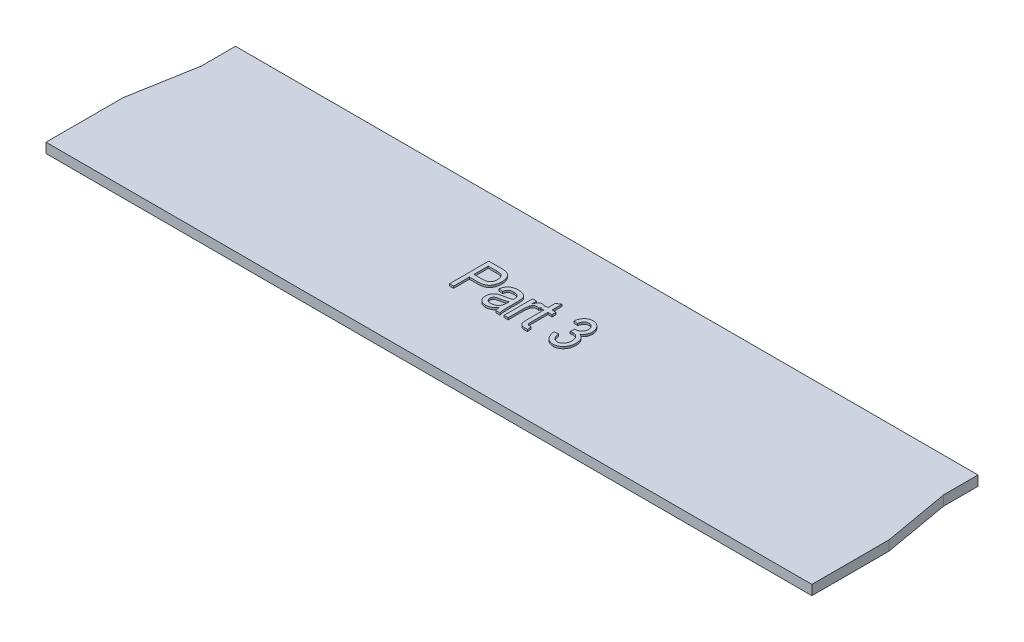
from build123d import *

# Parameters (mm, degrees)
EXTRUDE_1_DEPTH = 1
EXTRUDE_2_DEPTH = 0.2


with BuildPart() as part:
    # 草图1 → 凸台-拉伸1 (new body)
    with BuildSketch(Plane(origin=(0, 0, 0), x_dir=(1, 0, 0), z_dir=(0, 1, 0))):
        Polygon((2.190869955, 19.109345509), (77.809130045, 19.109345509), (77.809130045, 15.611907886), (79, 8.858148766), (79, 1), (1, 1), (1, 8.858148766), (2.190869955, 15.611907886), align=None)
    extrude(amount=EXTRUDE_1_DEPTH)

    # 草图2 → 凸台-拉伸2 (add)
    # profile 1 of 5: a face of its own
    with BuildSketch(Plane(origin=(0, 1, 0), x_dir=(1, 0, 0), z_dir=(0, 1, 0))):
        with BuildLine():
            Line((34.233766234, 8.858148766), (34.233766234, 12.858148766))
            Line((34.233766234, 12.858148766), (35.465909091, 12.858148766))
            add(Edge.make_bspline(
                [(35.465909091, 12.858148766), (35.501089701, 12.858181779), (35.568771935, 12.858245289), (35.66670203, 12.853454118), (35.757748694, 12.848612762), (35.841592555, 12.839271072), (35.91829705, 12.829070285), (35.987783839, 12.816323171), (36.050066797, 12.800212981), (36.088808821, 12.787197665), (36.107142857, 12.781038377)],
                knots=[0, 0, 0, 0, 1.301145482, 2.503209419, 3.626350361, 4.67304202, 5.622796861, 6.488461115, 7.284688674, 8, 8, 8, 8], degree=3))
            add(Edge.make_bspline(
                [(36.107142857, 12.781038377), (36.130358423, 12.772052688), (36.176734543, 12.754102602), (36.242057962, 12.718665471), (36.304372033, 12.67874198), (36.362970538, 12.633292023), (36.417509795, 12.581615081), (36.468843514, 12.524846601), (36.515951826, 12.461819568), (36.559355629, 12.393876387), (36.599771282, 12.321702525), (36.633141006, 12.244415416), (36.66311694, 12.163644533), (36.685924054, 12.078443855), (36.705198235, 11.989416055), (36.717474366, 11.896291311), (36.726224055, 11.799062476), (36.726917856, 11.732899447), (36.727272727, 11.699057857)],
                knots=[0, 0, 0, 0, 0.897158766, 1.79219156, 2.674738776, 3.564969572, 4.462552928, 5.381685756, 6.322532571, 7.297145314, 8.28871417, 9.302465757, 10.330585605, 11.393732126, 12.480975679, 13.614163778, 14.779673607, 16, 16, 16, 16], degree=3))
            add(Edge.make_bspline(
                [(36.727272727, 11.699057857), (36.726585621, 11.654653614), (36.725241804, 11.567809329), (36.712047583, 11.440788958), (36.690119212, 11.320355602), (36.660200288, 11.205930695), (36.621343486, 11.097687037), (36.573227886, 10.995909075), (36.516782632, 10.90023231), (36.452342251, 10.81047822), (36.376405446, 10.728780347), (36.286785177, 10.658888414), (36.185387789, 10.599112456), (36.070947488, 10.55159992), (35.944631636, 10.513222636), (35.805295064, 10.487060315), (35.653476145, 10.471907484), (35.54819644, 10.469690197), (35.493506494, 10.468538377)],
                knots=[0, 0, 0, 0, 1.066125632, 2.085091685, 3.062630143, 4.003547869, 4.922307223, 5.820454748, 6.703048758, 7.586837887, 8.469431897, 9.371589709, 10.306565591, 11.287746888, 12.340181319, 13.471797101, 14.68666727, 16, 16, 16, 16], degree=3))
            Line((35.493506494, 10.468538377), (34.649350649, 10.468538377))
            Line((34.649350649, 10.468538377), (34.649350649, 8.858148766))
            Line((34.649350649, 8.858148766), (34.233766234, 8.858148766))
        make_face()
        with BuildLine():
            Line((34.649350649, 10.936070844), (35.519480519, 10.936070844))
            add(Edge.make_bspline(
                [(35.519480519, 10.936070844), (35.552501498, 10.93681272), (35.616479993, 10.938250112), (35.709342112, 10.945916861), (35.795359422, 10.960539078), (35.874504066, 10.980563295), (35.946555719, 11.006674937), (36.011873819, 11.038073182), (36.070085429, 11.075864541), (36.122107556, 11.119059905), (36.166446222, 11.169248122), (36.206330829, 11.223918009), (36.238676272, 11.285650991), (36.265109299, 11.352982218), (36.286580226, 11.425692171), (36.300746898, 11.504345275), (36.309802096, 11.588727366), (36.31104708, 11.647085042), (36.311688312, 11.677142273)],
                knots=[0, 0, 0, 0, 1.269306236, 2.459294321, 3.577321076, 4.618943517, 5.592639886, 6.518111891, 7.397820391, 8.253919533, 9.107995395, 9.965041305, 10.848919063, 11.777714976, 12.741869721, 13.757527659, 14.845010431, 16, 16, 16, 16], degree=3))
            add(Edge.make_bspline(
                [(36.311688312, 11.677142273), (36.310765137, 11.716184394), (36.30897874, 11.791733142), (36.290500762, 11.900402475), (36.261917242, 12.000647399), (36.220083411, 12.090451484), (36.171159231, 12.169200885), (36.117587582, 12.236565301), (36.057754773, 12.289489933), (36.002070205, 12.322476498), (35.953166964, 12.343280432), (35.909587514, 12.356118707), (35.859265755, 12.366202838), (35.802383311, 12.375033413), (35.739050988, 12.382479323), (35.669147934, 12.386866262), (35.592569505, 12.390466225), (35.539236826, 12.390564787), (35.511363636, 12.390616299)],
                knots=[0, 0, 0, 0, 1.500314686, 2.903195123, 4.226916567, 5.498136997, 6.699407891, 7.786731959, 8.797026544, 9.75363827, 10.261964553, 10.838097333, 11.497334866, 12.234733717, 13.051831226, 13.948971176, 14.928073425, 16, 16, 16, 16], degree=3))
            Line((35.511363636, 12.390616299), (34.649350649, 12.390616299))
            Line((34.649350649, 12.390616299), (34.649350649, 10.936070844))
        make_face(mode=Mode.SUBTRACT)
    # profile 2 of 5: a face of its own
    with BuildSketch(Plane(origin=(0, 1, 0), x_dir=(1, 0, 0), z_dir=(0, 1, 0))):
        with BuildLine():
            add(Edge.make_bspline(
                [(38.857142857, 9.259122792), (38.823067483, 9.223381439), (38.756820384, 9.153895454), (38.6507058, 9.061697321), (38.542482329, 8.983179817), (38.432007529, 8.918516424), (38.319186647, 8.868669376), (38.204736438, 8.832333957), (38.087675551, 8.810593935), (38.008746561, 8.807668241), (37.969155844, 8.806200714)],
                knots=[0, 0, 0, 0, 1.153539222, 2.242634972, 3.279759983, 4.274221825, 5.22822196, 6.156113319, 7.075107937, 8, 8, 8, 8], degree=3))
            add(Edge.make_bspline(
                [(37.969155844, 8.806200714), (37.938544112, 8.806702209), (37.878751174, 8.807681763), (37.791406888, 8.818904715), (37.708573227, 8.835168748), (37.630798743, 8.860197201), (37.557283494, 8.890629349), (37.488971214, 8.929220956), (37.4249666, 8.973945392), (37.366852771, 9.026098775), (37.313902521, 9.083394862), (37.268313323, 9.146573934), (37.22902651, 9.21410423), (37.197233605, 9.28683482), (37.173235337, 9.364271972), (37.155042457, 9.446189973), (37.144494717, 9.53292452), (37.143410047, 9.592427746), (37.142857143, 9.622759156)],
                knots=[0, 0, 0, 0, 1.119001789, 2.185711136, 3.216323131, 4.202252203, 5.169072212, 6.121655869, 7.066185889, 8.01954035, 8.972175414, 9.914421449, 10.863296537, 11.8249363, 12.810865371, 13.824179086, 14.890888434, 16, 16, 16, 16], degree=3))
            add(Edge.make_bspline(
                [(37.142857143, 9.622759156), (37.143932606, 9.663173205), (37.146025987, 9.741838793), (37.167337429, 9.856005136), (37.200117261, 9.963293974), (37.247746696, 10.062738846), (37.306660267, 10.15315695), (37.375781775, 10.234176274), (37.455070047, 10.304243941), (37.529356779, 10.354168333), (37.595383424, 10.388793208), (37.651401012, 10.41283649), (37.71321753, 10.435444493), (37.780798685, 10.456827943), (37.854680966, 10.474982601), (37.934513842, 10.492139003), (38.020351218, 10.507461648), (38.079789269, 10.516059842), (38.11038961, 10.520486429)],
                knots=[0, 0, 0, 0, 1.315736636, 2.561069718, 3.771447986, 4.962594692, 6.141438714, 7.279577219, 8.422657877, 9.579430637, 10.186831949, 10.850275834, 11.564458882, 12.331400109, 13.159047923, 14.042804356, 14.992381924, 16, 16, 16, 16], degree=3))
            add(Edge.make_bspline(
                [(38.11038961, 10.520486429), (38.151563364, 10.52753606), (38.231129665, 10.541159134), (38.345497171, 10.565018107), (38.45172869, 10.589098046), (38.549009631, 10.615144968), (38.638589299, 10.64088261), (38.719191984, 10.668482921), (38.791995127, 10.69617624), (38.83618001, 10.717948919), (38.857142857, 10.728278637)],
                knots=[0, 0, 0, 0, 1.28905306, 2.491033145, 3.605049172, 4.650122195, 5.598672662, 6.480605859, 7.279146522, 8, 8, 8, 8], degree=3))
            Line((38.857142857, 10.728278637), (38.857142857, 10.84678513))
            add(Edge.make_bspline(
                [(38.857142857, 10.84678513), (38.856969287, 10.869260907), (38.85663616, 10.912398026), (38.850290971, 10.974373306), (38.84281926, 11.031469097), (38.830944268, 11.083527355), (38.81423265, 11.129946177), (38.795927184, 11.171999549), (38.773448567, 11.208854431), (38.7549107, 11.229603359), (38.745941558, 11.239642273)],
                knots=[0, 0, 0, 0, 1.290137808, 2.476124807, 3.574920544, 4.596386969, 5.535069845, 6.404438809, 7.22802268, 8, 8, 8, 8], degree=3))
            add(Edge.make_bspline(
                [(38.745941558, 11.239642273), (38.732475579, 11.252748535), (38.705218591, 11.279277405), (38.657387476, 11.312446256), (38.60445528, 11.340756563), (38.546601116, 11.364428992), (38.483454003, 11.382426889), (38.414810331, 11.393835914), (38.341131668, 11.402614956), (38.290072577, 11.403267518), (38.263798701, 11.403603312)],
                knots=[0, 0, 0, 0, 0.860333652, 1.741433159, 2.657216257, 3.608602534, 4.602004448, 5.660502074, 6.796146289, 8, 8, 8, 8], degree=3))
            add(Edge.make_bspline(
                [(38.263798701, 11.403603312), (38.217692876, 11.402745229), (38.131411772, 11.401139439), (38.011042822, 11.379460493), (37.908204775, 11.346867043), (37.835624691, 11.305481499), (37.787495452, 11.26389277), (37.754343727, 11.227513476), (37.724306161, 11.184724494), (37.696706006, 11.136201514), (37.670606868, 11.08217131), (37.64836931, 11.021282267), (37.626816969, 10.955170445), (37.615980358, 10.908302548), (37.61038961, 10.884122792)],
                knots=[0, 0, 0, 0, 1.779102865, 3.329361478, 4.707868851, 5.930643941, 6.523657754, 7.16004944, 7.827207895, 8.539060925, 9.31524689, 10.142348672, 11.041613586, 12, 12, 12, 12], degree=3))
            Line((37.61038961, 10.884122792), (37.194805195, 10.936070844))
            add(Edge.make_bspline(
                [(37.194805195, 10.936070844), (37.202778013, 10.973233807), (37.218313658, 11.04564868), (37.247919768, 11.149880603), (37.284772924, 11.246068825), (37.326559761, 11.334464647), (37.374120029, 11.414867296), (37.426654663, 11.487861109), (37.486553201, 11.551856997), (37.551004992, 11.609629606), (37.622705571, 11.659644754), (37.70140371, 11.702574173), (37.787657636, 11.738020527), (37.88024782, 11.768544563), (37.980730234, 11.790458398), (38.087955505, 11.80792523), (38.20275219, 11.817375354), (38.281640356, 11.818571915), (38.32224026, 11.819187727)],
                knots=[0, 0, 0, 0, 1.146744962, 2.234520216, 3.265547189, 4.251500875, 5.181194384, 6.080940409, 6.959092981, 7.820811418, 8.688273039, 9.590681915, 10.520124471, 11.498613844, 12.528476545, 13.619677679, 14.774963812, 16, 16, 16, 16], degree=3))
            add(Edge.make_bspline(
                [(38.32224026, 11.819187727), (38.353908723, 11.818695992), (38.415419782, 11.817740871), (38.505081665, 11.811054571), (38.589455198, 11.800931337), (38.668724423, 11.785620866), (38.742487701, 11.764890335), (38.811824317, 11.741995783), (38.875546782, 11.713580892), (38.950817754, 11.669558349), (39.033599734, 11.608403581), (39.116749001, 11.525751856), (39.177611709, 11.432365333), (39.211080541, 11.347419942), (39.228889788, 11.274306524), (39.241202432, 11.213699848), (39.250595864, 11.146709171), (39.258672566, 11.073893293), (39.265018632, 10.995120214), (39.270084395, 10.910697872), (39.272236704, 10.820281464), (39.272560019, 10.75804108), (39.272727273, 10.725843572)],
                knots=[0, 0, 0, 0, 1.116479382, 2.168587404, 3.16840818, 4.111316371, 5.011567079, 5.868311402, 6.683862369, 7.465978748, 8.938885496, 10.301521261, 11.576846205, 12.839874513, 13.499268829, 14.228894422, 15.019458851, 15.883290383, 16.811756148, 17.805505868, 18.864768531, 20, 20, 20, 20], degree=3))
            Line((39.272727273, 10.725843572), (39.272727273, 10.071622792))
            add(Edge.make_bspline(
                [(39.272727273, 10.071622792), (39.272551513, 10.016968006), (39.272217386, 9.913066826), (39.274455907, 9.765076791), (39.275522904, 9.633027456), (39.278481314, 9.516702973), (39.280051507, 9.416271016), (39.284653514, 9.331892207), (39.288190599, 9.263374296), (39.297309696, 9.163699951), (39.321576945, 9.028410546), (39.358282126, 8.914879309), (39.376623377, 8.858148766)],
                knots=[0, 0, 0, 0, 1.33924071, 2.545956183, 3.626711962, 4.574996917, 5.397345641, 6.087652113, 6.645549812, 7.078325684, 8.540065522, 10, 10, 10, 10], degree=3))
            Line((39.376623377, 8.858148766), (38.961038961, 8.858148766))
            add(Edge.make_bspline(
                [(38.961038961, 8.858148766), (38.948245976, 8.887409424), (38.922069232, 8.947281981), (38.893574419, 9.044391592), (38.870458634, 9.148761662), (38.86166034, 9.221681905), (38.857142857, 9.259122792)],
                knots=[0, 0, 0, 0, 0.920202936, 1.882900402, 2.912975517, 4, 4, 4, 4], degree=3))
        make_face()
        with BuildLine():
            add(Edge.make_bspline(
                [(38.857142857, 10.312694221), (38.836400804, 10.302487447), (38.793246003, 10.281251782), (38.723968837, 10.252048866), (38.647551753, 10.224466339), (38.563552332, 10.199056735), (38.472886922, 10.172633538), (38.374789331, 10.1486434), (38.269719413, 10.125920093), (38.197271139, 10.11205406), (38.159902597, 10.104902013)],
                knots=[0, 0, 0, 0, 0.759937497, 1.581085096, 2.470290631, 3.429739441, 4.465916236, 5.57487507, 6.749129853, 8, 8, 8, 8], degree=3))
            add(Edge.make_bspline(
                [(38.159902597, 10.104902013), (38.11845878, 10.098157383), (38.042080869, 10.085727524), (37.937467888, 10.064520452), (37.853300918, 10.040723537), (37.786551226, 10.015267386), (37.733488871, 9.985351223), (37.688391426, 9.950969812), (37.648940634, 9.911034785), (37.616651859, 9.865247426), (37.590512449, 9.815657743), (37.571358949, 9.762193451), (37.561116248, 9.704857903), (37.559345191, 9.665544822), (37.558441558, 9.645486429)],
                knots=[0, 0, 0, 0, 1.792080477, 3.302672748, 4.55256871, 5.521793876, 6.343933024, 7.143043091, 7.93511388, 8.729789758, 9.525220353, 10.321404951, 11.1435441, 12, 12, 12, 12], degree=3))
            add(Edge.make_bspline(
                [(37.558441558, 9.645486429), (37.559654391, 9.614674271), (37.561989754, 9.555344098), (37.589942226, 9.47169819), (37.632179564, 9.396953166), (37.693002446, 9.33377068), (37.768499478, 9.283029497), (37.858232314, 9.247654023), (37.960224981, 9.225330691), (38.032611001, 9.223005801), (38.070616883, 9.22178513)],
                knots=[0, 0, 0, 0, 0.982989349, 1.89278952, 2.793465746, 3.712871111, 4.674195932, 5.684718148, 6.784373966, 8, 8, 8, 8], degree=3))
            add(Edge.make_bspline(
                [(38.070616883, 9.22178513), (38.107787461, 9.222907909), (38.181080615, 9.225121812), (38.288211822, 9.246469848), (38.390592656, 9.27934958), (38.486082502, 9.326829582), (38.573465744, 9.384528047), (38.649881315, 9.452730363), (38.714768651, 9.529562853), (38.758679692, 9.601657347), (38.787707253, 9.664855993), (38.806385556, 9.717854947), (38.821143991, 9.775902932), (38.835826267, 9.838435735), (38.844602734, 9.906711697), (38.852299495, 9.979749593), (38.856037653, 10.058057398), (38.856766056, 10.111934275), (38.857142857, 10.139804611)],
                knots=[0, 0, 0, 0, 1.295816986, 2.555099171, 3.797272685, 5.038800039, 6.264426397, 7.441439978, 8.600861566, 9.761973723, 10.374641393, 11.025690135, 11.719692907, 12.46426932, 13.265486335, 14.119543836, 15.027246062, 16, 16, 16, 16], degree=3))
            Line((38.857142857, 10.139804611), (38.857142857, 10.312694221))
        make_face(mode=Mode.SUBTRACT)
    # profile 3 of 5: a face of its own
    with BuildSketch(Plane(origin=(0, 1, 0), x_dir=(1, 0, 0), z_dir=(0, 1, 0))):
        with BuildLine():
            Line((39.792207792, 8.858148766), (39.792207792, 11.767239675))
            Line((39.792207792, 11.767239675), (40.207792208, 11.767239675))
            Line((40.207792208, 11.767239675), (40.207792208, 11.302953961))
            add(Edge.make_bspline(
                [(40.207792208, 11.302953961), (40.218395912, 11.327945473), (40.238833632, 11.376114446), (40.271762856, 11.443851205), (40.302091907, 11.506113284), (40.333124308, 11.561127423), (40.362738208, 11.609902791), (40.39232402, 11.651913829), (40.42097394, 11.687288107), (40.457610034, 11.725221216), (40.505316344, 11.762608857), (40.566308938, 11.79577662), (40.631668254, 11.815398098), (40.676278803, 11.817914007), (40.698863636, 11.819187727)],
                knots=[0, 0, 0, 0, 1.289569891, 2.485534132, 3.577799513, 4.579141338, 5.485278766, 6.287741315, 7.018535776, 7.645783751, 8.790134626, 9.882778151, 10.92812119, 12, 12, 12, 12], degree=3))
            add(Edge.make_bspline(
                [(40.698863636, 11.819187727), (40.731281914, 11.817254458), (40.797658065, 11.813296104), (40.896556225, 11.781449803), (40.996539315, 11.732805101), (41.058567047, 11.687149158), (41.090909091, 11.663343572)],
                knots=[0, 0, 0, 0, 0.90443484, 1.851822771, 2.879913239, 4, 4, 4, 4], degree=3))
            Line((41.090909091, 11.663343572), (40.935064935, 11.247759156))
            add(Edge.make_bspline(
                [(40.935064935, 11.247759156), (40.911102094, 11.255742996), (40.864211798, 11.271365709), (40.793032347, 11.287501619), (40.722976921, 11.297793399), (40.67644146, 11.299073588), (40.653409091, 11.299707208)],
                knots=[0, 0, 0, 0, 1.052765664, 2.060043406, 3.039833393, 4, 4, 4, 4], degree=3))
            add(Edge.make_bspline(
                [(40.653409091, 11.299707208), (40.632974771, 11.298683784), (40.592454839, 11.296654401), (40.533607291, 11.278022968), (40.476673534, 11.250699176), (40.424713966, 11.210344622), (40.376722624, 11.161541518), (40.33738543, 11.102253289), (40.304158075, 11.034953035), (40.289333982, 10.985852904), (40.281655844, 10.960421494)],
                knots=[0, 0, 0, 0, 0.90278596, 1.790165981, 2.712081054, 3.687667699, 4.687827769, 5.731629286, 6.825097509, 8, 8, 8, 8], degree=3))
            add(Edge.make_bspline(
                [(40.281655844, 10.960421494), (40.270104084, 10.913220947), (40.246829937, 10.818122671), (40.225003562, 10.671182457), (40.2106488, 10.520233237), (40.208751633, 10.417977763), (40.207792208, 10.36626565)],
                knots=[0, 0, 0, 0, 0.970935534, 1.956212433, 2.966426232, 4, 4, 4, 4], degree=3))
            Line((40.207792208, 10.36626565), (40.207792208, 8.858148766))
            Line((40.207792208, 8.858148766), (39.792207792, 8.858148766))
        make_face()
    # profile 4 of 5: a face of its own
    with BuildSketch(Plane(origin=(0, 1, 0), x_dir=(1, 0, 0), z_dir=(0, 1, 0))):
        with BuildLine():
            Line((42.181818182, 9.22178513), (42.233766234, 8.806200714))
            add(Edge.make_bspline(
                [(42.233766234, 8.806200714), (42.17965368, 8.806200714), (42.07711039, 8.806200714), (41.9745671, 8.806200714), (41.926136364, 8.806200714)],
                knots=[0, 0, 0, 0, 1.055408971, 2, 2, 2, 2], degree=3))
            add(Edge.make_bspline(
                [(41.926136364, 8.806200714), (41.891950474, 8.806830274), (41.826664547, 8.808032564), (41.734241339, 8.825404536), (41.651095731, 8.84905511), (41.579512413, 8.886427354), (41.518870575, 8.93249551), (41.467266469, 8.985640813), (41.427521794, 9.04775193), (41.401445602, 9.105588171), (41.386724787, 9.159418132), (41.377548629, 9.20917011), (41.368159353, 9.267538755), (41.36259259, 9.335113796), (41.356262276, 9.411081156), (41.353829921, 9.49613014), (41.350958238, 9.59000187), (41.350755364, 9.655764495), (41.350649351, 9.690129286)],
                knots=[0, 0, 0, 0, 1.327648624, 2.53545457, 3.64742125, 4.678330939, 5.655056999, 6.600489706, 7.543399924, 8.509463526, 9.055951624, 9.710279637, 10.476870183, 11.354490926, 12.34657729, 13.441983227, 14.663287688, 16, 16, 16, 16], degree=3))
            Line((41.350649351, 9.690129286), (41.350649351, 11.35165526))
            Line((41.350649351, 11.35165526), (41.038961039, 11.35165526))
            Line((41.038961039, 11.35165526), (41.038961039, 11.767239675))
            Line((41.038961039, 11.767239675), (41.350649351, 11.767239675))
            Line((41.350649351, 11.767239675), (41.350649351, 12.494512403))
            Line((41.350649351, 12.494512403), (41.766233766, 12.806200714))
            Line((41.766233766, 12.806200714), (41.766233766, 11.767239675))
            Line((41.766233766, 11.767239675), (42.181818182, 11.767239675))
            Line((42.181818182, 11.767239675), (42.181818182, 11.35165526))
            Line((42.181818182, 11.35165526), (41.766233766, 11.35165526))
            Line((41.766233766, 11.35165526), (41.766233766, 9.629252662))
            add(Edge.make_bspline(
                [(41.766233766, 9.629252662), (41.766649016, 9.592967991), (41.767399777, 9.527366182), (41.773611535, 9.439895743), (41.782664465, 9.372368372), (41.796818539, 9.336625807), (41.80275974, 9.321622792)],
                knots=[0, 0, 0, 0, 1.396202311, 2.524300029, 3.380571947, 4, 4, 4, 4], degree=3))
            add(Edge.make_bspline(
                [(41.80275974, 9.321622792), (41.812640444, 9.306149606), (41.832229693, 9.275472834), (41.879462796, 9.243923198), (41.936607803, 9.224923031), (41.978450991, 9.222877987), (42.000811688, 9.22178513)],
                knots=[0, 0, 0, 0, 0.935281465, 1.854266853, 2.853335735, 4, 4, 4, 4], degree=3))
            add(Edge.make_bspline(
                [(42.000811688, 9.22178513), (42.027597403, 9.22178513), (42.0879329, 9.22178513), (42.148268398, 9.22178513), (42.181818182, 9.22178513)],
                knots=[0, 0, 0, 0, 0.887892377, 2, 2, 2, 2], degree=3))
        make_face()
    # profile 5 of 5: a face of its own
    with BuildSketch(Plane(origin=(0, 1, 0), x_dir=(1, 0, 0), z_dir=(0, 1, 0))):
        with BuildLine():
            Line((43.792207792, 9.949057857), (44.207792208, 10.001005909))
            add(Edge.make_bspline(
                [(44.207792208, 10.001005909), (44.21315211, 9.969557036), (44.223596596, 9.908274694), (44.244146716, 9.820086791), (44.266575234, 9.737565837), (44.292570385, 9.66148868), (44.320905856, 9.59111222), (44.352327984, 9.526885192), (44.387459085, 9.468818349), (44.425434421, 9.416878034), (44.46637129, 9.370818283), (44.51008347, 9.330940803), (44.556980343, 9.29727412), (44.606614862, 9.26925626), (44.659772482, 9.248471432), (44.715408747, 9.232608474), (44.774341131, 9.223785759), (44.814637014, 9.222461696), (44.835227273, 9.22178513)],
                knots=[0, 0, 0, 0, 1.392235382, 2.712957193, 3.95076201, 5.123471921, 6.220028287, 7.260520794, 8.240826993, 9.178593426, 10.065213643, 10.926376853, 11.755607984, 12.580369742, 13.407158359, 14.241002189, 15.101193065, 16, 16, 16, 16], degree=3))
            add(Edge.make_bspline(
                [(44.835227273, 9.22178513), (44.857747742, 9.22221363), (44.902012108, 9.223055855), (44.966878515, 9.235602857), (45.029899811, 9.252732355), (45.089989304, 9.279412196), (45.148205101, 9.312194946), (45.204620111, 9.351746709), (45.257017351, 9.400642311), (45.308042246, 9.454391266), (45.355103181, 9.514060718), (45.395680824, 9.579232884), (45.429855161, 9.648952535), (45.458532142, 9.722385834), (45.479053836, 9.800726412), (45.495958874, 9.882413004), (45.504438722, 9.969172315), (45.505797183, 10.028318479), (45.506493506, 10.058635779)],
                knots=[0, 0, 0, 0, 0.904038564, 1.776903143, 2.648138989, 3.525264603, 4.411852617, 5.332561374, 6.2875971, 7.288147468, 8.311042921, 9.337403868, 10.368883854, 11.429611823, 12.501164111, 13.621320171, 14.780729868, 16, 16, 16, 16], degree=3))
            add(Edge.make_bspline(
                [(45.506493506, 10.058635779), (45.505757445, 10.087061782), (45.504324357, 10.1424063), (45.496442164, 10.223360154), (45.482000097, 10.300056002), (45.460421511, 10.37228435), (45.434868433, 10.441157776), (45.402251987, 10.505270109), (45.363762625, 10.564988294), (45.320218065, 10.619888482), (45.272142626, 10.669366532), (45.221441169, 10.713406146), (45.167291625, 10.750004454), (45.111058502, 10.780820894), (45.051208296, 10.802972056), (44.989485119, 10.820603802), (44.924551297, 10.830341949), (44.880441223, 10.831555891), (44.857954545, 10.83217474)],
                knots=[0, 0, 0, 0, 1.208507307, 2.352925112, 3.453685551, 4.520081629, 5.553915499, 6.572344605, 7.570902253, 8.569592363, 9.545641393, 10.499968035, 11.418701314, 12.319183888, 13.218416966, 14.125267075, 15.044288268, 16, 16, 16, 16], degree=3))
            add(Edge.make_bspline(
                [(44.857954545, 10.83217474), (44.837620796, 10.831534809), (44.794274837, 10.830170652), (44.726020455, 10.818373305), (44.650484149, 10.801792265), (44.598643126, 10.785521477), (44.571428571, 10.776979935)],
                knots=[0, 0, 0, 0, 0.832645691, 1.774971563, 2.831945141, 4, 4, 4, 4], degree=3))
            Line((44.571428571, 10.776979935), (44.623376623, 11.247759156))
            Line((44.623376623, 11.247759156), (44.685876623, 11.242077338))
            add(Edge.make_bspline(
                [(44.685876623, 11.242077338), (44.709995156, 11.242350868), (44.757058567, 11.242884618), (44.825889702, 11.252748067), (44.891549215, 11.265815787), (44.953372804, 11.285648526), (45.012111961, 11.310028346), (45.066851532, 11.340930508), (45.118590169, 11.376963347), (45.166402745, 11.418128604), (45.209324546, 11.464667665), (45.247666859, 11.514628152), (45.279360052, 11.568790921), (45.305695767, 11.626096733), (45.32588918, 11.68737382), (45.340626136, 11.752300249), (45.348459193, 11.821162658), (45.349906805, 11.868141901), (45.350649351, 11.892239675)],
                knots=[0, 0, 0, 0, 1.104467345, 2.155189185, 3.181695374, 4.170183668, 5.126157628, 6.092295424, 7.04536858, 8.012620263, 8.977961638, 9.942904556, 10.893715412, 11.848320646, 12.828840281, 13.845861792, 14.895045293, 16, 16, 16, 16], degree=3))
            add(Edge.make_bspline(
                [(45.350649351, 11.892239675), (45.348786706, 11.935405297), (45.345207037, 12.0183619), (45.317728983, 12.136516285), (45.269847226, 12.241101331), (45.203931913, 12.330519037), (45.124611297, 12.402575469), (45.036000773, 12.456574015), (44.937728994, 12.488568272), (44.869277056, 12.49250665), (44.834415584, 12.494512403)],
                knots=[0, 0, 0, 0, 1.168747258, 2.246123166, 3.262822778, 4.26410748, 5.234436762, 6.148309006, 7.056963545, 8, 8, 8, 8], degree=3))
            add(Edge.make_bspline(
                [(44.834415584, 12.494512403), (44.798191364, 12.492828134), (44.727722699, 12.489551648), (44.626957068, 12.458295357), (44.534251488, 12.410414294), (44.466672904, 12.352825448), (44.418783697, 12.298301095), (44.38499427, 12.252355426), (44.354969411, 12.201264355), (44.329523132, 12.144571683), (44.30503248, 12.083842491), (44.287712382, 12.017004995), (44.270412468, 11.946096183), (44.263372971, 11.896651541), (44.25974026, 11.871135779)],
                knots=[0, 0, 0, 0, 1.389180941, 2.702438466, 4.019316734, 5.377896697, 6.085434137, 6.807430375, 7.567469407, 8.358691296, 9.195188439, 10.081130764, 11.009773198, 12, 12, 12, 12], degree=3))
            Line((44.25974026, 11.871135779), (43.844155844, 11.923083831))
            add(Edge.make_bspline(
                [(43.844155844, 11.923083831), (43.850960765, 11.962687115), (43.864235135, 12.039941294), (43.891968396, 12.151105801), (43.924974653, 12.25495641), (43.964937314, 12.350921265), (44.010313114, 12.439833473), (44.061651614, 12.52131781), (44.118284132, 12.595909247), (44.182178154, 12.661547561), (44.250086741, 12.720008301), (44.322049332, 12.770496076), (44.396782886, 12.813952567), (44.475519187, 12.848961866), (44.557518915, 12.876722606), (44.64319264, 12.89614936), (44.732100155, 12.907633797), (44.792444681, 12.909267958), (44.823051948, 12.910096818)],
                knots=[0, 0, 0, 0, 1.259750421, 2.457396855, 3.589696629, 4.673763457, 5.713494597, 6.716289503, 7.690389722, 8.644478697, 9.583164327, 10.496506905, 11.397350125, 12.289843847, 13.194037124, 14.107891875, 15.040306322, 16, 16, 16, 16], degree=3))
            add(Edge.make_bspline(
                [(44.823051948, 12.910096818), (44.855302054, 12.909145515), (44.918749218, 12.90727397), (45.012003254, 12.892913764), (45.101688209, 12.870530971), (45.187565316, 12.837898237), (45.268871251, 12.794913045), (45.34760875, 12.744507372), (45.422450205, 12.684115377), (45.492222651, 12.614723734), (45.556267518, 12.538789718), (45.612441716, 12.457202779), (45.66069031, 12.371340286), (45.69900303, 12.279958425), (45.728949691, 12.183979741), (45.750832885, 12.083248147), (45.764232803, 11.977559273), (45.765556656, 11.905537585), (45.766233766, 11.868700714)],
                knots=[0, 0, 0, 0, 0.987546189, 1.94284647, 2.883618689, 3.814886987, 4.749064414, 5.696240478, 6.674807358, 7.688712876, 8.706405422, 9.713376545, 10.718845743, 11.717906576, 12.742863162, 13.794678478, 14.872046121, 16, 16, 16, 16], degree=3))
            add(Edge.make_bspline(
                [(45.766233766, 11.868700714), (45.764983424, 11.824221703), (45.762541523, 11.737354846), (45.739004157, 11.611347145), (45.701650426, 11.493130386), (45.649551187, 11.383490887), (45.584629467, 11.28299193), (45.506650371, 11.194094777), (45.41765554, 11.115297003), (45.349987788, 11.073901029), (45.315746753, 11.052953961)],
                knots=[0, 0, 0, 0, 1.090109576, 2.128968013, 3.132278696, 4.123864162, 5.09769889, 6.057339906, 7.016980922, 8, 8, 8, 8], degree=3))
            add(Edge.make_bspline(
                [(45.315746753, 11.052953961), (45.347199379, 11.043276318), (45.408653818, 11.024367432), (45.493434853, 10.981785574), (45.5707407, 10.932334811), (45.639814882, 10.873020702), (45.701249564, 10.803823168), (45.756106751, 10.72426173), (45.803239024, 10.633575987), (45.845820638, 10.5340262), (45.879190558, 10.425683265), (45.904828422, 10.310713302), (45.919366701, 10.189150975), (45.921160496, 10.106021831), (45.922077922, 10.063505909)],
                knots=[0, 0, 0, 0, 0.945190562, 1.846782401, 2.71900073, 3.580139159, 4.456653473, 5.37426406, 6.352713278, 7.392141409, 8.485180558, 9.608884637, 10.777077804, 12, 12, 12, 12], degree=3))
            add(Edge.make_bspline(
                [(45.922077922, 10.063505909), (45.921281906, 10.018270627), (45.919727837, 9.929957353), (45.903475892, 9.800516905), (45.878879624, 9.677402227), (45.843793466, 9.56017324), (45.798454204, 9.449736897), (45.742463331, 9.345461628), (45.677001566, 9.247336643), (45.601632938, 9.156738177), (45.519221786, 9.075620851), (45.432864337, 9.003131683), (45.341908572, 8.942319088), (45.247129166, 8.892079782), (45.148102209, 8.853930203), (45.045357614, 8.826048772), (44.93830095, 8.809581134), (44.865586504, 8.807337713), (44.828733766, 8.806200714)],
                knots=[0, 0, 0, 0, 1.16797173, 2.280242353, 3.364490462, 4.408173669, 5.436152277, 6.443028727, 7.460738993, 8.478233232, 9.481512989, 10.444418881, 11.386528098, 12.302557467, 13.209825675, 14.12198051, 15.04819242, 16, 16, 16, 16], degree=3))
            add(Edge.make_bspline(
                [(44.828733766, 8.806200714), (44.794588153, 8.807102365), (44.727328596, 8.808878423), (44.628579706, 8.823962976), (44.53382492, 8.848172581), (44.443420597, 8.882701233), (44.356310763, 8.925879833), (44.273845499, 8.97964362), (44.19499832, 9.042975881), (44.120909887, 9.11544385), (44.053207556, 9.19656485), (43.991714468, 9.28402098), (43.937701829, 9.378273697), (43.893735517, 9.480245638), (43.856110515, 9.587897066), (43.826019543, 9.702085993), (43.803952556, 9.823133697), (43.796177099, 9.906500029), (43.792207792, 9.949057857)],
                knots=[0, 0, 0, 0, 0.959274814, 1.889566238, 2.800731978, 3.703256649, 4.604498869, 5.528396462, 6.464265966, 7.442996794, 8.436156864, 9.429840861, 10.444772988, 11.483305447, 12.546329121, 13.647537524, 14.799087218, 16, 16, 16, 16], degree=3))
        make_face()
    extrude(amount=EXTRUDE_2_DEPTH)


solid = part.part
